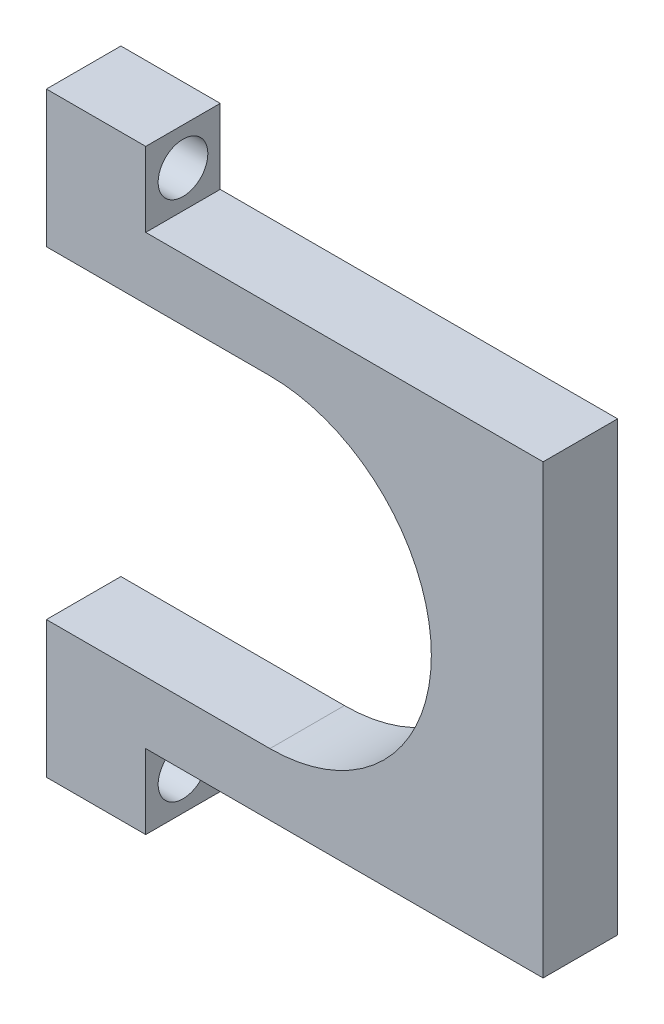
from build123d import *

# Parameters (mm, degrees)
BOSS_EXTRUDE1_DEPTH = 3
SKETCH3_W           = 4
SKETCH3_H           = 3
BOSS_EXTRUDE2_DEPTH = 3
SKETCH4_W           = 4
SKETCH4_H           = 3
BOSS_EXTRUDE3_DEPTH = 3
SKETCH5_R           = 1
CUT_EXTRUDE1_DEPTH  = 23.363531015
SKETCH6_R           = 1
CUT_EXTRUDE2_DEPTH  = 23.363531015


with BuildPart() as part:
    # Sketch2 → Boss-Extrude1 (new body)
    with BuildSketch(Plane.XY):
        with BuildLine():
            Line((-11.556982343, -12.333868379), (8.443017657, -12.333868379))
            Line((8.443017657, -12.333868379), (8.443017657, 5.666131621))
            Line((8.443017657, 5.666131621), (-11.556982343, 5.666131621))
            Line((-11.556982343, 5.666131621), (-11.556982343, 3.166131621))
            Line((-11.556982343, 3.166131621), (-2.556982343, 3.166131621))
            ThreePointArc((-2.556982343, 3.166131621), (3.943017657, -3.333868379), (-2.556982343, -9.833868379))
            Line((-2.556982343, -9.833868379), (-11.556982343, -9.833868379))
            Line((-11.556982343, -9.833868379), (-11.556982343, -12.333868379))
        make_face()
    extrude(amount=-BOSS_EXTRUDE1_DEPTH)

    # Sketch3 → Boss-Extrude2 (add)
    with BuildSketch(Plane(origin=(0, 5.666131621, 0), x_dir=(1, 0, 0), z_dir=(0, 1, 0))):
        with Locations((-9.556982343, 1.5)):
            Rectangle(SKETCH3_W, SKETCH3_H)
    extrude(amount=BOSS_EXTRUDE2_DEPTH)

    # Sketch4 → Boss-Extrude3 (add)
    with BuildSketch(Plane.XZ.offset(12.333868379)):
        with Locations((-9.556982343, -1.5)):
            Rectangle(SKETCH4_W, SKETCH4_H)
    extrude(amount=BOSS_EXTRUDE3_DEPTH)

    # Sketch5 → Cut-Extrude1 (cut, through all)
    with BuildSketch(Plane(origin=(-7.556982343, 0, 0), x_dir=(0, 0, -1), z_dir=(1, 0, 0))):
        with Locations((1.5, 7.166131621)):
            Circle(SKETCH5_R)
    extrude(amount=-CUT_EXTRUDE1_DEPTH, mode=Mode.SUBTRACT)

    # Sketch6 → Cut-Extrude2 (cut, through all)
    with BuildSketch(Plane(origin=(-7.556982343, 0, 0), x_dir=(0, 0, -1), z_dir=(1, 0, 0))):
        with Locations((1.5, -13.833868379)):
            Circle(SKETCH6_R)
    extrude(amount=-CUT_EXTRUDE2_DEPTH, mode=Mode.SUBTRACT)


solid = part.part
